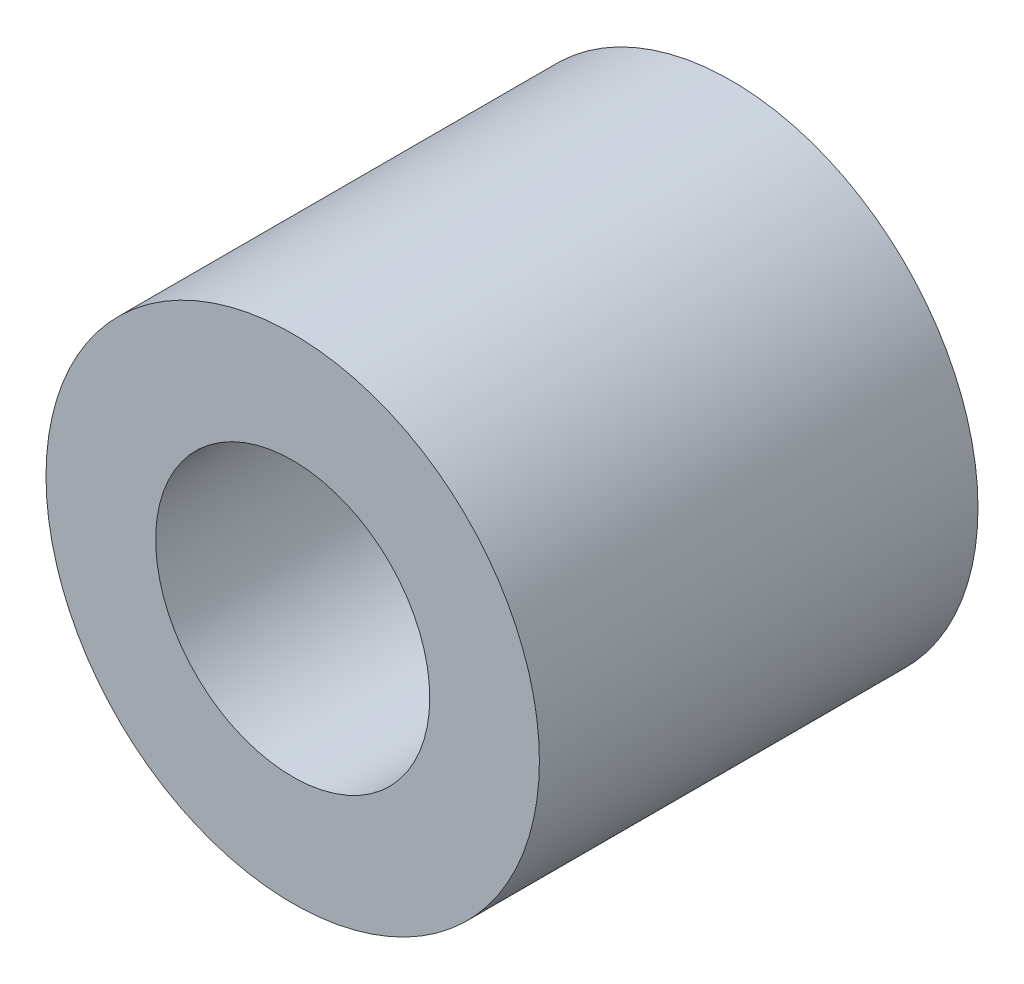
from build123d import *

# Parameters (mm, degrees)
SKETCH_2_R      = 9
SKETCH_2_R_2    = 5
EXTRUDE_1_DEPTH = 16


with BuildPart() as part:
    # 草图2 → 凸台-拉伸1 (new body)
    with BuildSketch(Plane.XY):
        Circle(SKETCH_2_R)
        Circle(SKETCH_2_R_2, mode=Mode.SUBTRACT)
    extrude(amount=EXTRUDE_1_DEPTH)


solid = part.part
